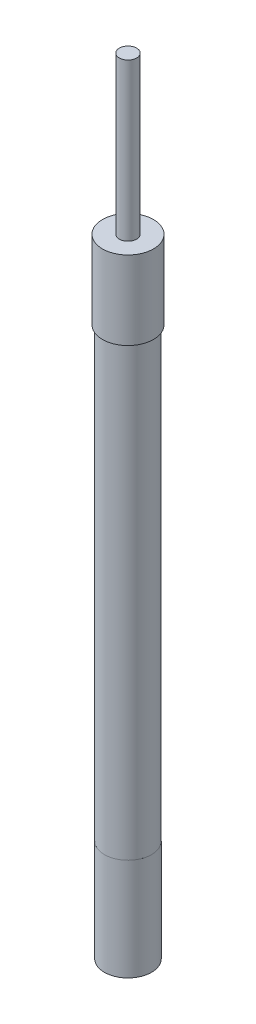
from build123d import *

# Parameters (mm, degrees)
SK_BULB_GUARD_R      = 6
BULB_GUARD_DEPTH     = 26
ELECTRODE_START      = 26
SK_ELECTRODE_BODY_R  = 6
ELECTRODE_BODY_DEPTH = 114
ELECTRODE_START_2    = 140
SK_ELECTRODE_CAP_R   = 6.5
ELECTRODE_CAP_DEPTH  = 20
CABLE_START          = 160
SK_CABLE_R           = 2.2
CABLE_DEPTH          = 40


with BuildPart() as part:
    # SK Bulb guard → Bulb guard (new body)
    with BuildSketch(Plane(origin=(0, 0, 0), x_dir=(1, 0, 0), z_dir=(0, 1, 0))):
        with Locations(Location((0, 0, 0), (0, 0, 270))):
            Circle(SK_BULB_GUARD_R)
    extrude(amount=BULB_GUARD_DEPTH)


with BuildPart() as body_2:
    # SK Electrode body → Electrode body (new body)
    with BuildSketch(Plane(origin=(0, 0, 0), x_dir=(1, 0, 0), z_dir=(0, 1, 0)).offset(ELECTRODE_START)):
        with Locations(Location((0, 0, 0), (0, 0, 90))):
            Circle(SK_ELECTRODE_BODY_R)
    extrude(amount=ELECTRODE_BODY_DEPTH)


with BuildPart() as body_3:
    # SK Electrode cap → Electrode cap (new body)
    with BuildSketch(Plane(origin=(0, 0, 0), x_dir=(1, 0, 0), z_dir=(0, 1, 0)).offset(ELECTRODE_START_2)):
        with Locations(Location((0, 0, 0), (0, 0, 270))):
            Circle(SK_ELECTRODE_CAP_R)
    extrude(amount=ELECTRODE_CAP_DEPTH)


with BuildPart() as body_4:
    # SK Cable → Cable (new body)
    with BuildSketch(Plane(origin=(0, 0, 0), x_dir=(1, 0, 0), z_dir=(0, 1, 0)).offset(CABLE_START)):
        with Locations(Location((0, 0, 0), (0, 0, 270))):
            Circle(SK_CABLE_R)
    extrude(amount=CABLE_DEPTH)


solid = Compound([part.part, body_2.part, body_3.part, body_4.part])
